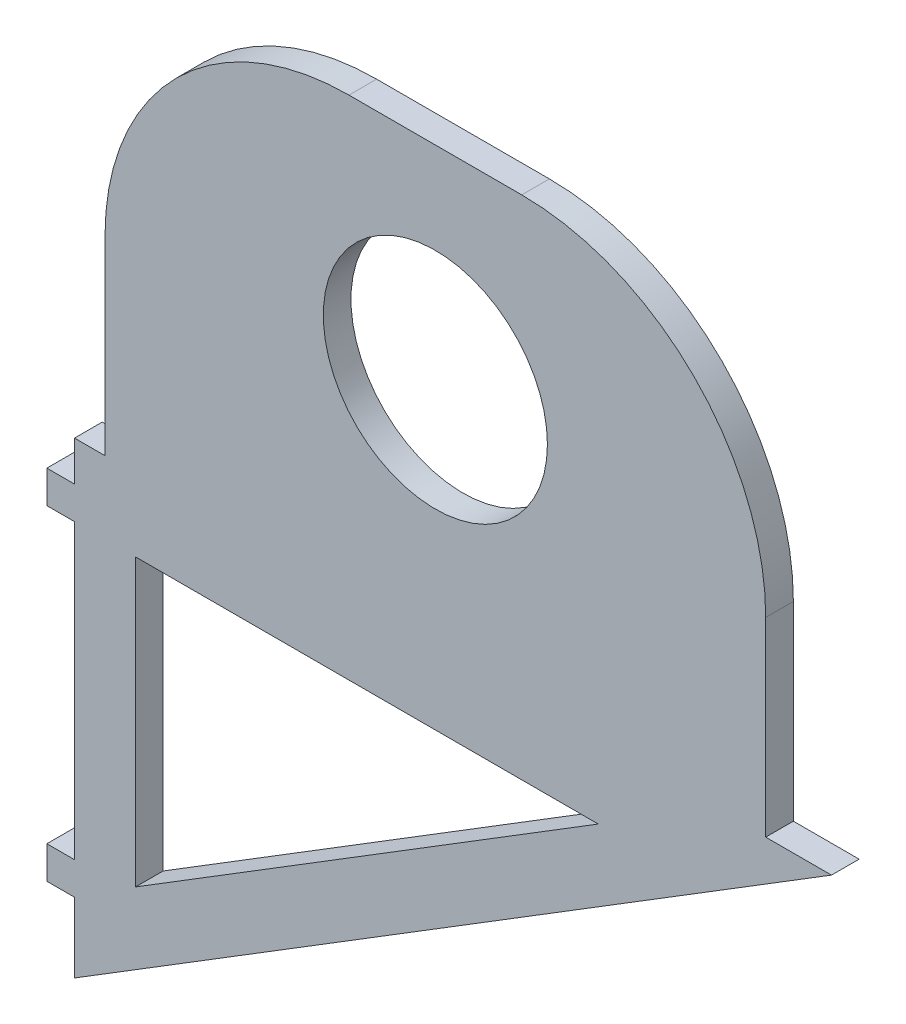
from build123d import *

# Parameters (mm, degrees)
SKETCH1_R           = 7
BOSS_EXTRUDE1_DEPTH = 1.7272
FILLET7_R           = 15.24


with BuildPart() as part:
    # Sketch1 → Boss-Extrude1 (new body)
    with BuildSketch(Plane.XY):
        Polygon((0, 0), (47.288728977, 29.21), (43.18, 29.21), (43.18, 56.3372), (1.905, 56.3372), (1.905, 29.21), (0, 29.21), (0, 26.7208), (-1.7272, 26.7208), (-1.7272, 24.6888), (0, 24.6888), (0, 6.4008), (-1.7272, 6.4008), (-1.7272, 4.3688), (0, 4.3688), align=None)
        with Locations((22.5425, 43.6372)):
            Circle(SKETCH1_R, mode=Mode.SUBTRACT)
        Polygon((3.81, 24.6888), (32.719325319, 24.6888), (3.81, 6.831661294), align=None, mode=Mode.SUBTRACT)
    extrude(amount=BOSS_EXTRUDE1_DEPTH)

    # Fillet7
    fillet7_edges = [part.edges().sort_by_distance(p)[0] for p in [
        (1.905, 56.3372, 0.8636),
        (43.18, 56.3372, 0.8636),
    ]]
    fillet(fillet7_edges, radius=FILLET7_R)


solid = part.part
